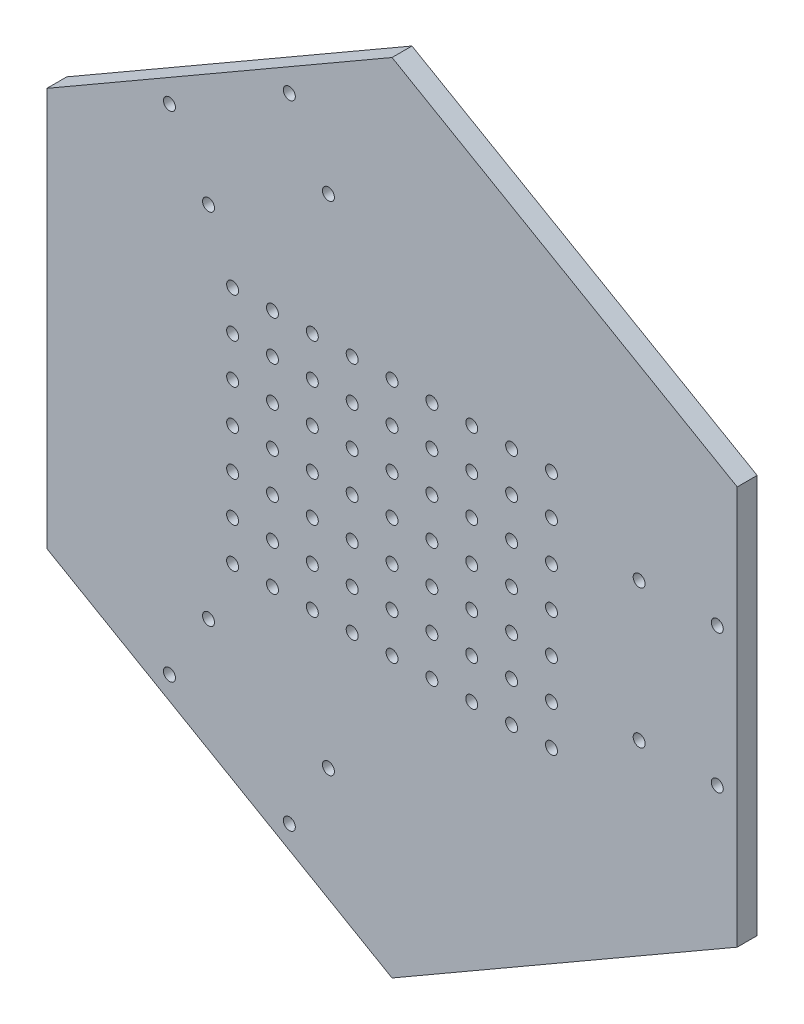
from build123d import *

# Parameters (mm, degrees)
EXTRUDE_1_DEPTH     = 5
SKETCH_2_R          = 1.5
CUT_EXTRUDE_1_DEPTH = 5
SKETCH_3_R          = 1.5
CUT_EXTRUDE_2_DEPTH = 133.382022949


with BuildPart() as part:
    # 草图1 → 凸台-拉伸1 (new body)
    with BuildSketch(Plane.XY):
        Polygon((86.602540378, 50), (0, 100), (-86.602540378, 50), (-86.602540378, -50), (0, -100), (86.602540378, -50), align=None)
    extrude(amount=EXTRUDE_1_DEPTH)

    # 草图2 → 切除-拉伸1 (cut)
    with BuildSketch(Plane(origin=(0, 0, 0), x_dir=(-1, 0, 0), z_dir=(0, 0, -1))):
        with Locations((-81.602540378, 17.365)):
            Circle(SKETCH_2_R)
        with Locations((-62.002540378, 17.37)):
            Circle(SKETCH_2_R)
        with Locations(Location((-62.002540378, -17.37, 0), (0, 0, 180))):
            Circle(SKETCH_2_R)
        with Locations(Location((-81.602540378, -17.365, 0), (0, 0, 180))):
            Circle(SKETCH_2_R)
        with Locations((55.839801326, 61.987372981)):
            Circle(SKETCH_2_R)
        with Locations((46.044131453, 45.010775067)):
            Circle(SKETCH_2_R)
        with Locations(Location((15.958408925, 62.380775067, 0), (0, 0, 180))):
            Circle(SKETCH_2_R)
        with Locations(Location((25.762739053, 79.352372981, 0), (0, 0, 180))):
            Circle(SKETCH_2_R)
        with Locations((25.762739053, -79.352372981)):
            Circle(SKETCH_2_R)
        with Locations((15.958408925, -62.380775067)):
            Circle(SKETCH_2_R)
        with Locations(Location((46.044131453, -45.010775067, 0), (0, 0, 180))):
            Circle(SKETCH_2_R)
        with Locations(Location((55.839801326, -61.987372981, 0), (0, 0, 180))):
            Circle(SKETCH_2_R)
    extrude(amount=-CUT_EXTRUDE_1_DEPTH, mode=Mode.SUBTRACT)

    # 草图3 → 切除-拉伸2 (cut, through all)
    with BuildSketch(Plane.XY.offset(5)):
        Circle(SKETCH_3_R)
        with Locations((10, 0)):
            Circle(SKETCH_3_R)
        with Locations((20, 0)):
            Circle(SKETCH_3_R)
        with Locations((30, 0)):
            Circle(SKETCH_3_R)
        with Locations((40, 0)):
            Circle(SKETCH_3_R)
        with Locations((10, 10)):
            Circle(SKETCH_3_R)
        with Locations((20, 10)):
            Circle(SKETCH_3_R)
        with Locations((30, 10)):
            Circle(SKETCH_3_R)
        with Locations((40, 10)):
            Circle(SKETCH_3_R)
        with Locations((10, 20)):
            Circle(SKETCH_3_R)
        with Locations((20, 20)):
            Circle(SKETCH_3_R)
        with Locations((30, 20)):
            Circle(SKETCH_3_R)
        with Locations((40, 20)):
            Circle(SKETCH_3_R)
        with Locations((10, 30)):
            Circle(SKETCH_3_R)
        with Locations((20, 30)):
            Circle(SKETCH_3_R)
        with Locations((30, 30)):
            Circle(SKETCH_3_R)
        with Locations((40, 30)):
            Circle(SKETCH_3_R)
        with Locations((0, 10)):
            Circle(SKETCH_3_R)
        with Locations((0, 20)):
            Circle(SKETCH_3_R)
        with Locations((0, 30)):
            Circle(SKETCH_3_R)
        with Locations(Location((0, -30, 0), (0, 0, 180))):
            Circle(SKETCH_3_R)
        with Locations(Location((0, -20, 0), (0, 0, 180))):
            Circle(SKETCH_3_R)
        with Locations(Location((0, -10, 0), (0, 0, 180))):
            Circle(SKETCH_3_R)
        with Locations(Location((40, -30, 0), (0, 0, 180))):
            Circle(SKETCH_3_R)
        with Locations(Location((30, -30, 0), (0, 0, 180))):
            Circle(SKETCH_3_R)
        with Locations(Location((20, -30, 0), (0, 0, 180))):
            Circle(SKETCH_3_R)
        with Locations(Location((10, -30, 0), (0, 0, 180))):
            Circle(SKETCH_3_R)
        with Locations(Location((40, -20, 0), (0, 0, 180))):
            Circle(SKETCH_3_R)
        with Locations(Location((30, -20, 0), (0, 0, 180))):
            Circle(SKETCH_3_R)
        with Locations(Location((20, -20, 0), (0, 0, 180))):
            Circle(SKETCH_3_R)
        with Locations(Location((10, -20, 0), (0, 0, 180))):
            Circle(SKETCH_3_R)
        with Locations(Location((40, -10, 0), (0, 0, 180))):
            Circle(SKETCH_3_R)
        with Locations(Location((30, -10, 0), (0, 0, 180))):
            Circle(SKETCH_3_R)
        with Locations(Location((20, -10, 0), (0, 0, 180))):
            Circle(SKETCH_3_R)
        with Locations(Location((10, -10, 0), (0, 0, 180))):
            Circle(SKETCH_3_R)
        with Locations((-10, -10)):
            Circle(SKETCH_3_R)
        with Locations((-20, -10)):
            Circle(SKETCH_3_R)
        with Locations((-30, -10)):
            Circle(SKETCH_3_R)
        with Locations((-40, -10)):
            Circle(SKETCH_3_R)
        with Locations((-10, -20)):
            Circle(SKETCH_3_R)
        with Locations((-20, -20)):
            Circle(SKETCH_3_R)
        with Locations((-30, -20)):
            Circle(SKETCH_3_R)
        with Locations((-40, -20)):
            Circle(SKETCH_3_R)
        with Locations((-10, -30)):
            Circle(SKETCH_3_R)
        with Locations((-20, -30)):
            Circle(SKETCH_3_R)
        with Locations((-30, -30)):
            Circle(SKETCH_3_R)
        with Locations((-40, -30)):
            Circle(SKETCH_3_R)
        with Locations(Location((-40, 30, 0), (0, 0, 180))):
            Circle(SKETCH_3_R)
        with Locations(Location((-30, 30, 0), (0, 0, 180))):
            Circle(SKETCH_3_R)
        with Locations(Location((-20, 30, 0), (0, 0, 180))):
            Circle(SKETCH_3_R)
        with Locations(Location((-10, 30, 0), (0, 0, 180))):
            Circle(SKETCH_3_R)
        with Locations(Location((-40, 20, 0), (0, 0, 180))):
            Circle(SKETCH_3_R)
        with Locations(Location((-30, 20, 0), (0, 0, 180))):
            Circle(SKETCH_3_R)
        with Locations(Location((-20, 20, 0), (0, 0, 180))):
            Circle(SKETCH_3_R)
        with Locations(Location((-10, 20, 0), (0, 0, 180))):
            Circle(SKETCH_3_R)
        with Locations(Location((-40, 10, 0), (0, 0, 180))):
            Circle(SKETCH_3_R)
        with Locations(Location((-30, 10, 0), (0, 0, 180))):
            Circle(SKETCH_3_R)
        with Locations(Location((-20, 10, 0), (0, 0, 180))):
            Circle(SKETCH_3_R)
        with Locations(Location((-10, 10, 0), (0, 0, 180))):
            Circle(SKETCH_3_R)
        with Locations(Location((-40, 0, 0), (0, 0, 180))):
            Circle(SKETCH_3_R)
        with Locations(Location((-30, 0, 0), (0, 0, 180))):
            Circle(SKETCH_3_R)
        with Locations(Location((-20, 0, 0), (0, 0, 180))):
            Circle(SKETCH_3_R)
        with Locations(Location((-10, 0, 0), (0, 0, 180))):
            Circle(SKETCH_3_R)
    extrude(amount=-CUT_EXTRUDE_2_DEPTH, mode=Mode.SUBTRACT)


solid = part.part
